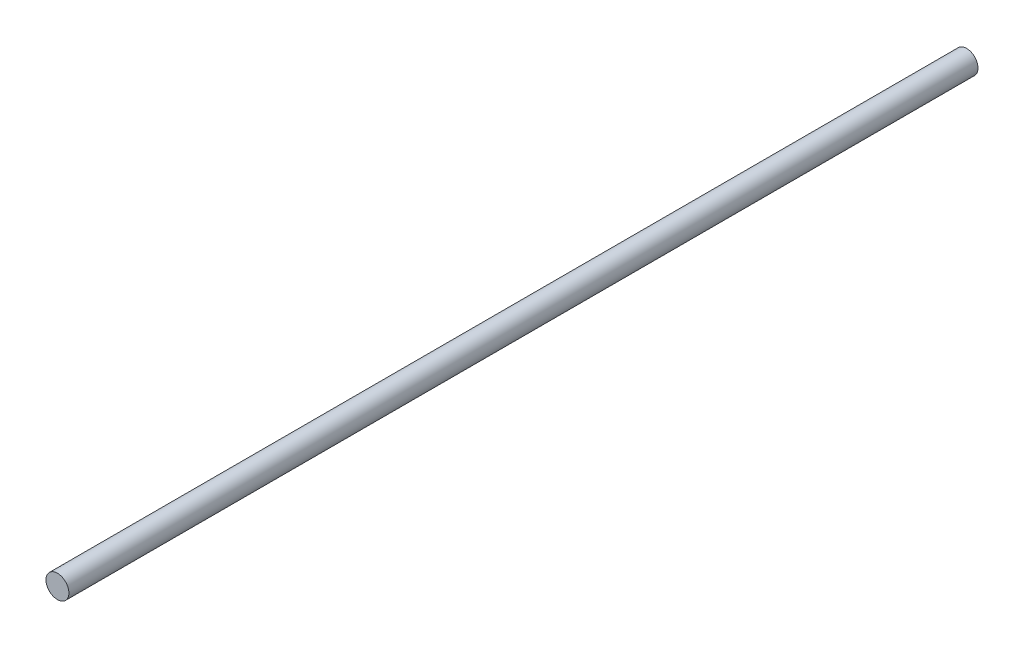
from build123d import *

# Parameters (mm, degrees)
SKETCH1_R           = 2.975
BOSS_EXTRUDE1_DEPTH = 236.22


with BuildPart() as part:
    # Sketch1 → Boss-Extrude1 (new body)
    with BuildSketch(Plane.XY):
        Circle(SKETCH1_R)
    extrude(amount=BOSS_EXTRUDE1_DEPTH)


solid = part.part
